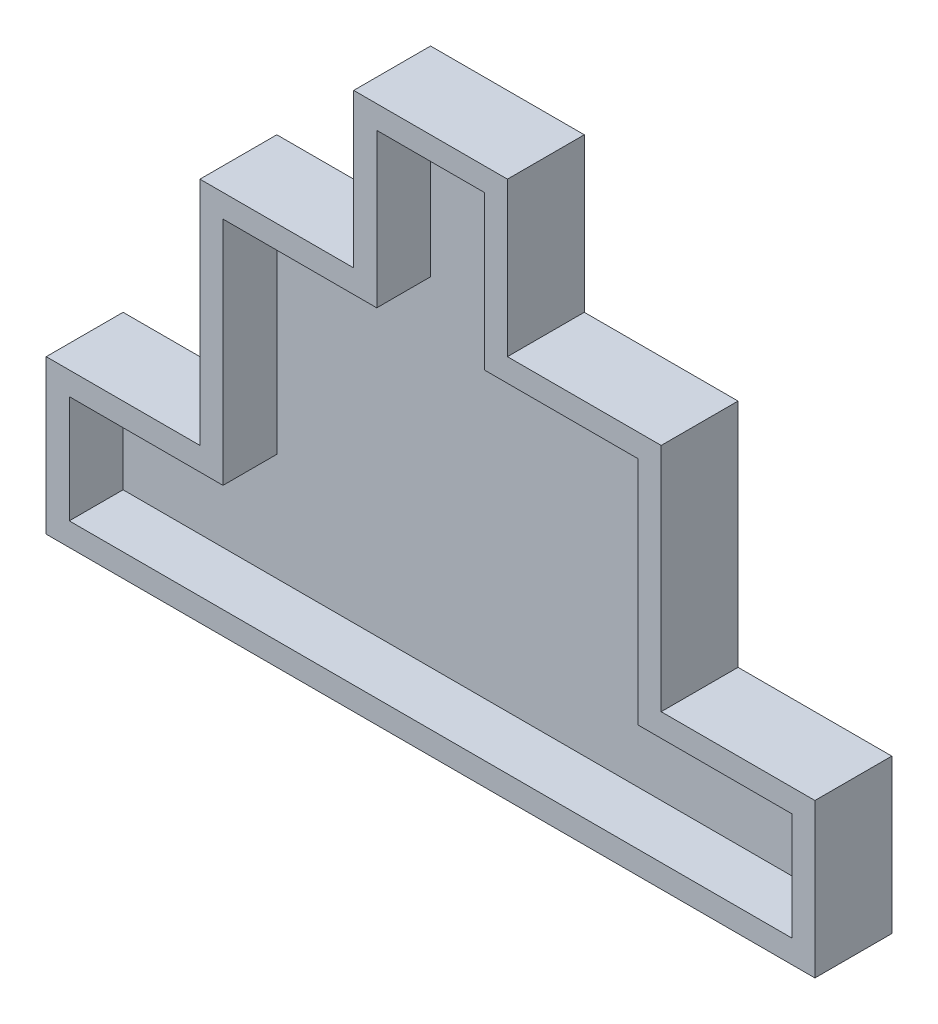
from build123d import *

# Parameters (mm, degrees)
BOSS_EXTRUDE2_DEPTH = 4.5
BOSS_EXTRUDE3_DEPTH = 10.5


with BuildPart() as part:
    # Sketch1 → Boss-Extrude2 (new body)
    with BuildSketch(Plane.XY):
        Polygon((-75, 15), (-45, 15), (-45, 60), (-15, 60), (-15, 90), (15, 90), (15, 60), (45, 60), (45, 15), (75, 15), (75, -15), (-75, -15), align=None)
    extrude(amount=BOSS_EXTRUDE2_DEPTH)

    # Sketch2 → Boss-Extrude3 (add)
    with BuildSketch(Plane.XY.offset(4.5)):
        Polygon((15, 90), (-15, 90), (-15, 60), (-45, 60), (-45, 15), (-75, 15), (-75, -15), (75, -15), (75, 15), (45, 15), (45, 60), (15, 60), align=None)
        Polygon((10.5, 55.5), (10.5, 85.5), (-10.5, 85.5), (-10.5, 55.5), (-40.5, 55.5), (-40.5, 10.5), (-70.5, 10.5), (-70.5, -10.5), (70.5, -10.5), (70.5, 10.5), (40.5, 10.5), (40.5, 55.5), align=None, mode=Mode.SUBTRACT)
    extrude(amount=BOSS_EXTRUDE3_DEPTH)


solid = part.part
